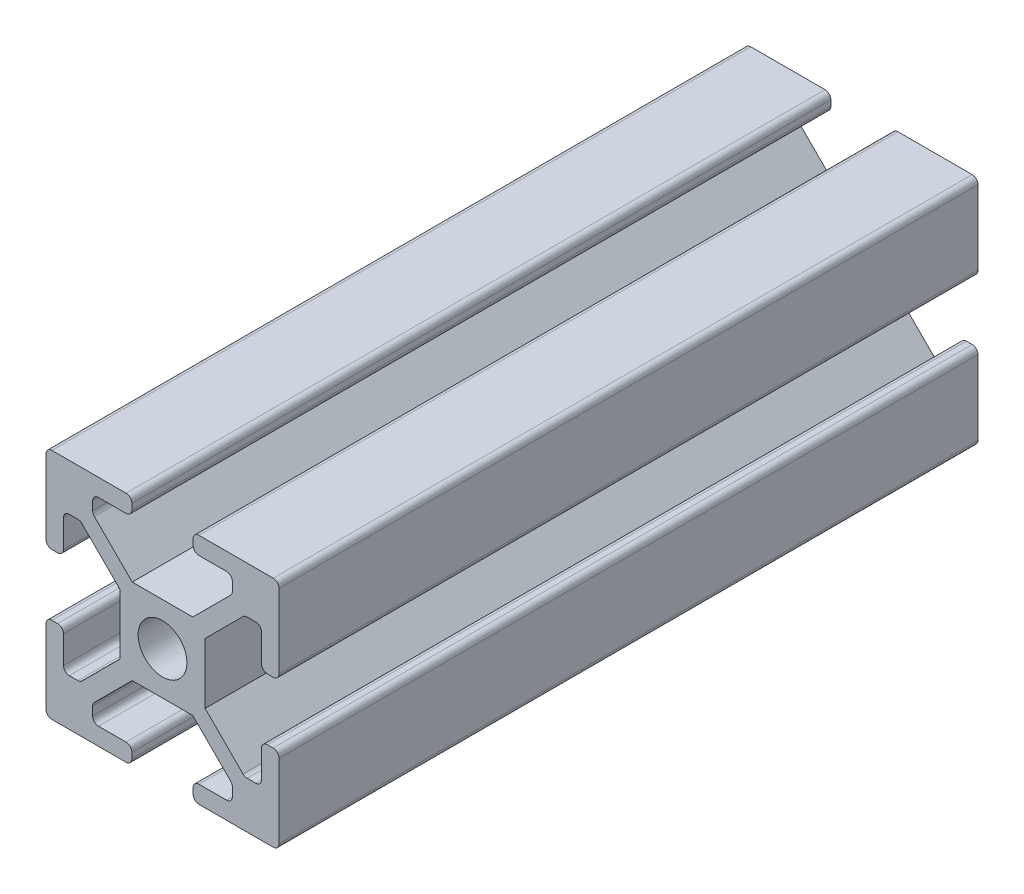
from build123d import *

# Parameters (mm, degrees)
BOSS_EXTRUDE1_DEPTH      = 30
FILLET1_R                = 0.5
CIRPATTERN3_COUNT        = 4
FILLET1_OF_CIRPATTERN3_R = 0.5
SKETCH3_R                = 2.095
CUT_EXTRUDE1_DEPTH       = 62.64414003


with BuildPart() as part:
    # Sketch2 → Boss-Extrude1 (new, symmetric)
    with BuildSketch(Plane.XY):
        Polygon((0, 3.66), (2.599339828, 3.66), (5.995, 7.055660172), (5.995, 8.5), (2.63, 8.5), (2.63, 10), (10, 10), (10, 2.63), (8.5, 2.63), (8.5, 5.995), (7.055660172, 5.995), (3.66, 2.599339828), (3.66, 0), (0, 0), align=None)
    boss_extrude1 = extrude(amount=BOSS_EXTRUDE1_DEPTH, both=True)

    # Fillet1
    fillet1_edges = [part.edges().sort_by_distance(p)[0] for p in [
        (5.995, 7.055660172, 0),
        (5.995, 8.5, 0),
        (2.63, 8.5, 0),
        (2.63, 10, 0),
        (10, 10, 0),
        (10, 2.63, 0),
        (8.5, 2.63, 0),
        (8.5, 5.995, 0),
        (7.055660172, 5.995, 0),
    ]]
    fillet(fillet1_edges, radius=FILLET1_R)

    # CirPattern3: Boss-Extrude1 ×4 about axis
    cirpattern3_axis = Axis((0, 0, 30), (0, 0, -1))
    for i in range(1, CIRPATTERN3_COUNT):
        add(boss_extrude1.rotate(cirpattern3_axis, i * 360 / CIRPATTERN3_COUNT))

    # Fillet1 of CirPattern3
    fillet1_of_cirpattern3_edges = [part.edges().sort_by_distance(p)[0] for p in [
        (7.055660172, -5.995, 0),
        (8.5, -5.995, 0),
        (8.5, -2.63, 0),
        (10, -2.63, 0),
        (10, -10, 0),
        (2.63, -10, 0),
        (2.63, -8.5, 0),
        (5.995, -8.5, 0),
        (5.995, -7.055660172, 0),
        (-5.995, -7.055660172, 0),
        (-5.995, -8.5, 0),
        (-2.63, -8.5, 0),
        (-2.63, -10, 0),
        (-10, -10, 0),
        (-10, -2.63, 0),
        (-8.5, -2.63, 0),
        (-8.5, -5.995, 0),
        (-7.055660172, -5.995, 0),
        (-7.055660172, 5.995, 0),
        (-8.5, 5.995, 0),
        (-8.5, 2.63, 0),
        (-10, 2.63, 0),
        (-10, 10, 0),
        (-2.63, 10, 0),
        (-2.63, 8.5, 0),
        (-5.995, 8.5, 0),
        (-5.995, 7.055660172, 0),
    ]]
    fillet(fillet1_of_cirpattern3_edges, radius=FILLET1_OF_CIRPATTERN3_R)

    # Sketch3 → Cut-Extrude1 (cut, through all)
    with BuildSketch(Plane.XY.offset(30)):
        Circle(SKETCH3_R)
    extrude(amount=-CUT_EXTRUDE1_DEPTH, mode=Mode.SUBTRACT)


solid = part.part
